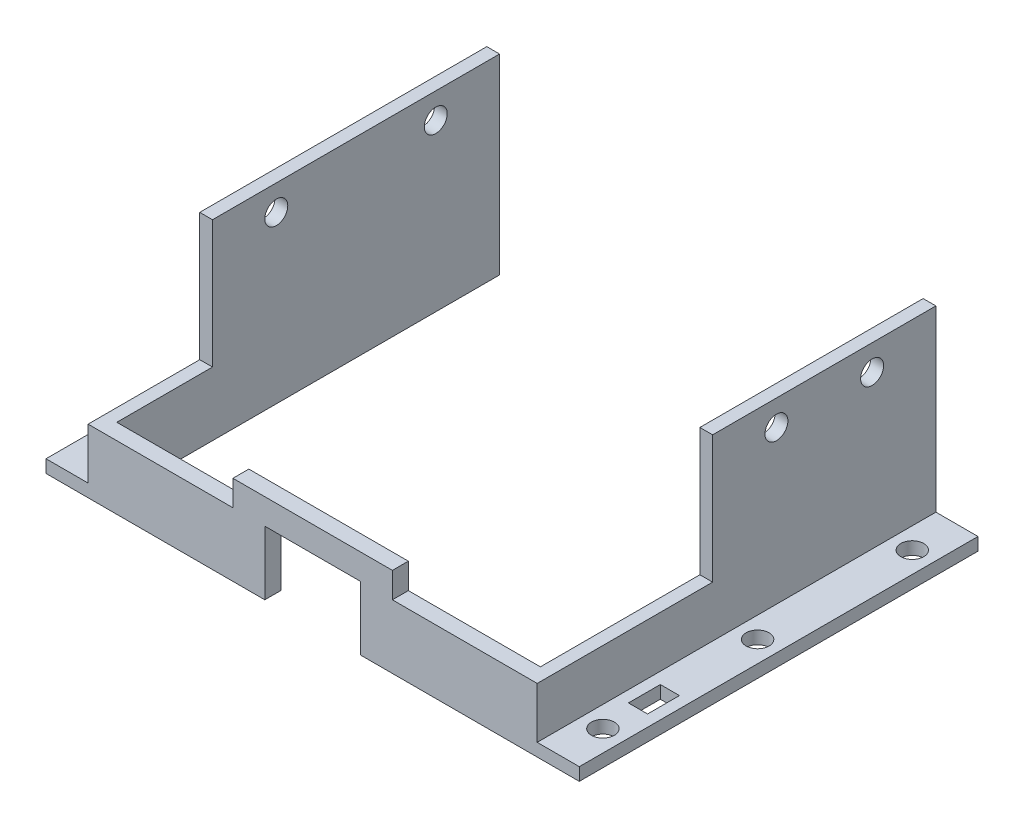
from build123d import *

# Parameters (mm, degrees)
SKETCH1_W                 = 70.4
SKETCH1_H                 = 2
BOSS_EXTRUDE2_DEPTH       = 10
SKETCH2_W                 = 2
SKETCH2_H                 = 55
BOSS_EXTRUDE3_DEPTH       = 10
SKETCH3_W                 = 19
SKETCH3_H                 = 3
BOSS_EXTRUDE4_DEPTH       = 2
SKETCH4_W                 = 15
SKETCH4_H                 = 10
CUT_EXTRUDE2_DEPTH        = 2
SKETCH5_W                 = 2
SKETCH5_H                 = 3
BOSS_EXTRUDE5_DEPTH       = 1
SKETCH6_W                 = 2
SKETCH6_H                 = 3
BOSS_EXTRUDE6_DEPTH       = 1
SKETCH7_W                 = 57
SKETCH7_H                 = 2
BOSS_EXTRUDE7_DEPTH       = 6.6
SKETCH8_W                 = 57
SKETCH8_H                 = 2
BOSS_EXTRUDE8_DEPTH       = 6.6
BOSS_EXTRUDE9_DEPTH       = 5
SKETCH12_W                = 2
SKETCH12_H                = 5
SKETCH12_H_2              = 40
SKETCH12_H_3              = 30
BOSS_EXTRUDE10_DEPTH      = 20
BOSS_EXTRUDE11_DEPTH      = 3
SKETCH14_W                = 0.5
SKETCH14_H                = 9
CUT_EXTRUDE3_DEPTH        = 3
SKETCH15_W                = 38.4
SKETCH15_H                = 45
CUT_EXTRUDE4_DEPTH        = 3
BOSS_EXTRUDE12_DEPTH      = 0.5
SKETCH17_R                = 1.8
SKETCH17_W                = 3
SKETCH17_H                = 5
CUT_EXTRUDE6_DEPTH        = 3
CUT_EXTRUDE7_DEPTH        = 116
CUT_EXTRUDE7_DEPTH_BACK   = 44
SKETCH18_W                = 45
SKETCH18_H                = 3
SKETCH19_R                = 1.8
CUT_EXTRUDE8_DEPTH        = 10
SKETCH20_R                = 1.8
CUT_EXTRUDE9_DEPTH        = 10
BOSS_EXTRUDE15_DEPTH      = 2
BOSS_EXTRUDE15_DEPTH_BACK = 23
SKETCH25_W                = 2.5
SKETCH25_H                = 4


with BuildPart() as part:
    # Sketch1 → Boss-Extrude2 (new body)
    with BuildSketch(Plane(origin=(0, 0, 0), x_dir=(1, 0, 0), z_dir=(0, 1, 0))):
        with Locations((35.2, 1)):
            Rectangle(SKETCH1_W, SKETCH1_H)
    extrude(amount=BOSS_EXTRUDE2_DEPTH)

    # Sketch2 → Boss-Extrude3 (add)
    with BuildSketch(Plane(origin=(0, 10, 0), x_dir=(1, 0, 0), z_dir=(0, 1, 0))):
        with Locations((1, 29.5)):
            Rectangle(SKETCH2_W, SKETCH2_H)
        with Locations((69.4, 29.5)):
            Rectangle(SKETCH2_W, SKETCH2_H)
    extrude(amount=-BOSS_EXTRUDE3_DEPTH)

    # Sketch3 → Boss-Extrude4 (add)
    with BuildSketch(Plane.XY):
        with Locations((35.2, 11.5)):
            Rectangle(SKETCH3_W, SKETCH3_H)
    extrude(amount=-BOSS_EXTRUDE4_DEPTH)

    # Sketch4 → Cut-Extrude2 (cut)
    with BuildSketch(Plane.XY):
        with Locations((35.2, 5)):
            Rectangle(SKETCH4_W, SKETCH4_H)
    extrude(amount=-CUT_EXTRUDE2_DEPTH, mode=Mode.SUBTRACT)

    # Sketch5 → Boss-Extrude5 (add)
    with BuildSketch(Plane.ZY.offset(-25.7)):
        with Locations((-1, 11.5)):
            Rectangle(SKETCH5_W, SKETCH5_H)
    extrude(amount=BOSS_EXTRUDE5_DEPTH)

    # Sketch6 → Boss-Extrude6 (add)
    with BuildSketch(Plane(origin=(44.7, 0, 0), x_dir=(0, 0, -1), z_dir=(1, 0, 0))):
        with Locations((1, 11.5)):
            Rectangle(SKETCH6_W, SKETCH6_H)
    extrude(amount=BOSS_EXTRUDE6_DEPTH)

    # Sketch7 → Boss-Extrude7 (add)
    with BuildSketch(Plane.ZY):
        with Locations((-28.5, 1)):
            Rectangle(SKETCH7_W, SKETCH7_H)
    extrude(amount=BOSS_EXTRUDE7_DEPTH)

    # Sketch8 → Boss-Extrude8 (add)
    with BuildSketch(Plane(origin=(70.4, 0, 0), x_dir=(0, 0, -1), z_dir=(1, 0, 0))):
        with Locations((28.5, 1)):
            Rectangle(SKETCH8_W, SKETCH8_H)
    extrude(amount=BOSS_EXTRUDE8_DEPTH)

    # Sketch10 → Boss-Extrude9 (add)
    with BuildSketch(Plane(origin=(0, 0, -57), x_dir=(-1, 0, 0), z_dir=(0, 0, -1))):
        Polygon((-2, 10), (-2, 0), (6.6, 0), (6.6, 2), (0, 2), (0, 10), align=None)
        Polygon((-77, 0), (-68.4, 0), (-68.4, 10), (-70.4, 10), (-70.4, 2), (-77, 2), align=None)
    extrude(amount=BOSS_EXTRUDE9_DEPTH)

    # Sketch12 → Boss-Extrude10 (add)
    with BuildSketch(Plane(origin=(0, 10, 0), x_dir=(1, 0, 0), z_dir=(0, 1, 0))):
        with Locations((1, 59.5)):
            Rectangle(SKETCH12_W, SKETCH12_H)
        with Locations((1, 37)):
            Rectangle(SKETCH12_W, SKETCH12_H_2)
        with Locations((69.4, 42)):
            Rectangle(SKETCH12_W, SKETCH12_H_3)
        with Locations((69.4, 59.5)):
            Rectangle(SKETCH12_W, SKETCH12_H)
    extrude(amount=BOSS_EXTRUDE10_DEPTH)

    # Sketch13 → Boss-Extrude11 (add)
    with BuildSketch(Plane(origin=(0, 30, 0), x_dir=(1, 0, 0), z_dir=(0, 1, 0))):
        Polygon((0, 17), (35.2, 17), (35.2, 27), (70.4, 27), (70.4, 62), (0, 62), align=None)
    extrude(amount=BOSS_EXTRUDE11_DEPTH)

    # Sketch14 → Cut-Extrude3 (cut)
    with BuildSketch(Plane(origin=(0, 33, 0), x_dir=(1, 0, 0), z_dir=(0, 1, 0))):
        with Locations((11.7, 51)):
            Rectangle(SKETCH14_W, SKETCH14_H)
        with Locations((11.7, 38)):
            Rectangle(SKETCH14_W, SKETCH14_H)
        with Locations((11.7, 25.5)):
            Rectangle(SKETCH14_W, SKETCH14_H)
        with Locations((58.2, 51)):
            Rectangle(SKETCH14_W, SKETCH14_H)
        with Locations((58.2, 38)):
            Rectangle(SKETCH14_W, SKETCH14_H)
    extrude(amount=-CUT_EXTRUDE3_DEPTH, mode=Mode.SUBTRACT)

    # Sketch15 → Cut-Extrude4 (cut)
    with BuildSketch(Plane(origin=(0, 33, 0), x_dir=(1, 0, 0), z_dir=(0, 1, 0))):
        with Locations((35.2, 39.5)):
            Rectangle(SKETCH15_W, SKETCH15_H)
    extrude(amount=-CUT_EXTRUDE4_DEPTH, mode=Mode.SUBTRACT)

    # Sketch16 → Boss-Extrude12 (add)
    with BuildSketch(Plane.XY):
        Polygon((-6.6, 0), (27.7, 0), (27.7, 10), (42.7, 10), (42.7, 0), (77, 0), (77, 2), (70.4, 2), (70.4, 10), (45.7, 10), (45.7, 13), (24.7, 13), (24.7, 10), (0, 10), (0, 2), (-6.6, 2), align=None)
    extrude(amount=BOSS_EXTRUDE12_DEPTH)

    # Sketch17 → Cut-Extrude6 (cut)
    with BuildSketch(Plane(origin=(0, 2, 0), x_dir=(1, 0, 0), z_dir=(0, 1, 0))):
        with Locations(Location((-3.3, 55, 0), (0, 0, 270))):
            Circle(SKETCH17_R)
        with Locations(Location((73.7, 55, 0), (0, 0, 270))):
            Circle(SKETCH17_R)
        with Locations(Location((-3.3, 6.5, 0), (0, 0, 270))):
            Circle(SKETCH17_R)
        with Locations(Location((73.7, 6.5, 0), (0, 0, 270))):
            Circle(SKETCH17_R)
        with Locations(Location((-3.3, 30.75, 0), (0, 0, 270))):
            Circle(SKETCH17_R)
        with Locations(Location((73.7, 30.75, 0), (0, 0, 270))):
            Circle(SKETCH17_R)
        with Locations((-3.3, 14.5)):
            Rectangle(SKETCH17_W, SKETCH17_H)
        with Locations((73.7, 14.5)):
            Rectangle(SKETCH17_W, SKETCH17_H)
    extrude(amount=-CUT_EXTRUDE6_DEPTH, mode=Mode.SUBTRACT)

    # Sketch18 → Cut-Extrude7 (cut, two sides: drawn at the far end of the back side and taken through both)
    with BuildSketch(Plane(origin=(16, 0, 0), x_dir=(0, 0, -1), z_dir=(1, 0, 0)).offset(-CUT_EXTRUDE7_DEPTH_BACK)):
        with Locations((39.5, 31.5)):
            Rectangle(SKETCH18_W, SKETCH18_H)
    extrude(amount=CUT_EXTRUDE7_DEPTH + CUT_EXTRUDE7_DEPTH_BACK, mode=Mode.SUBTRACT)

    # Sketch19 → Cut-Extrude8 (cut)
    with BuildSketch(Plane(origin=(2, 0, 0), x_dir=(0, 0, -1), z_dir=(1, 0, 0))):
        with Locations((52, 26)):
            Circle(SKETCH19_R)
        with Locations((27, 26)):
            Circle(SKETCH19_R)
    extrude(amount=-CUT_EXTRUDE8_DEPTH, mode=Mode.SUBTRACT)

    # Sketch20 → Cut-Extrude9 (cut)
    with BuildSketch(Plane(origin=(70.4, 0, 0), x_dir=(0, 0, -1), z_dir=(1, 0, 0))):
        with Locations((52, 26)):
            Circle(SKETCH20_R)
        with Locations((37, 26)):
            Circle(SKETCH20_R)
    extrude(amount=-CUT_EXTRUDE9_DEPTH, mode=Mode.SUBTRACT)

    # Sketch25 → Boss-Extrude15 (add, two sides: drawn at the far end of the back side and taken through both)
    with BuildSketch(Plane.ZY.offset(-24.7).offset(-BOSS_EXTRUDE15_DEPTH_BACK)):
        with Locations((-0.75, 12)):
            Rectangle(SKETCH25_W, SKETCH25_H)
    extrude(amount=BOSS_EXTRUDE15_DEPTH + BOSS_EXTRUDE15_DEPTH_BACK)


solid = part.part
